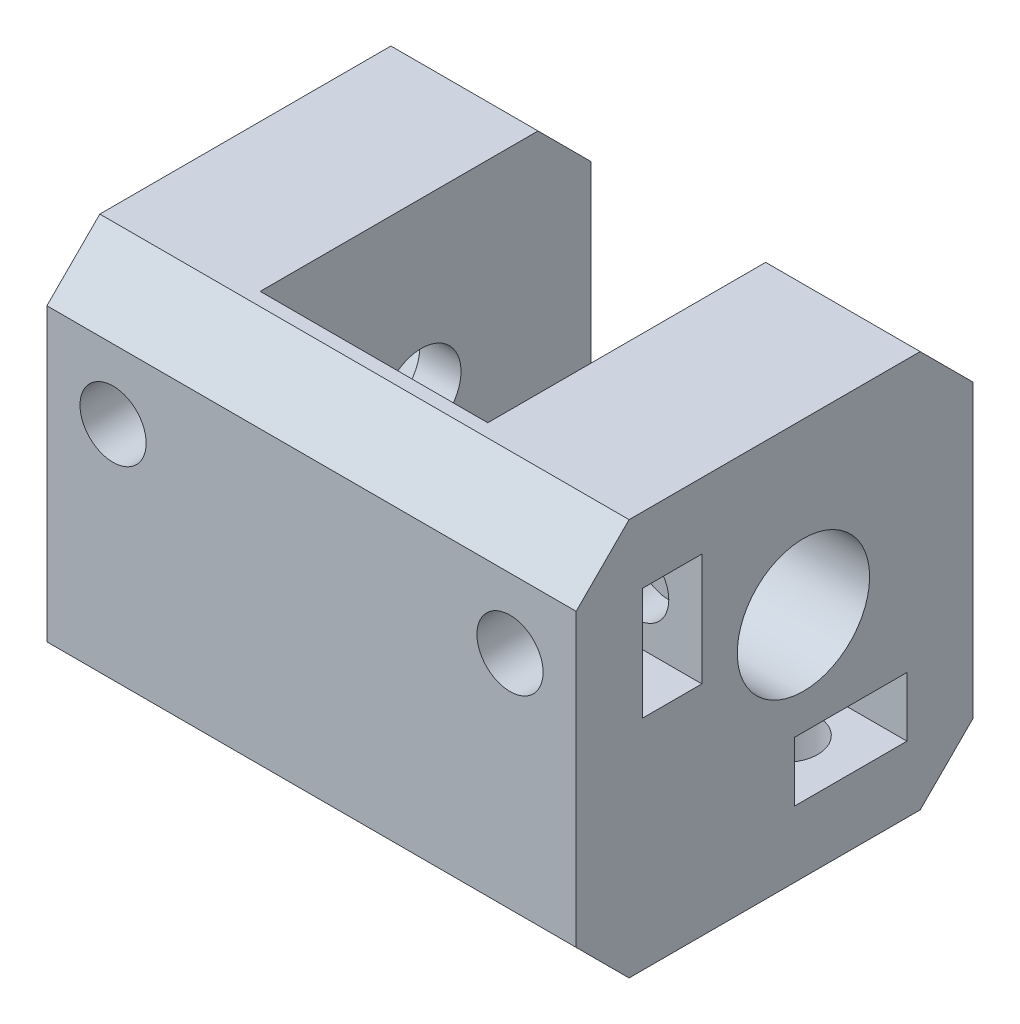
from build123d import *

# Parameters (mm, degrees)
SKETCH1_W           = 39.999999999
SKETCH1_H           = 30
BOSS_EXTRUDE1_DEPTH = 30
SKETCH2_W           = 17.2
SKETCH2_H           = 33.728920846
CUT_EXTRUDE1_DEPTH  = 25
SKETCH3_R           = 3
CUT_EXTRUDE2_DEPTH  = 77.38910698
SKETCH4_W           = 8.5
SKETCH4_H           = 4.5
SKETCH4_W_2         = 4.5
SKETCH4_H_2         = 8.5
CUT_EXTRUDE3_DEPTH  = 9
CUT_EXTRUDE4_START  = -40
SKETCH4_2_W         = 8.5
SKETCH4_2_H         = 4.5
SKETCH4_2_W_2       = 4.5
SKETCH4_2_H_2       = 8.5
CUT_EXTRUDE4_DEPTH  = 9
SKETCH5_R           = 2.5
CUT_EXTRUDE5_DEPTH  = 12
CHAMFER1_SIZE       = 4
SKETCH6_R           = 5
CUT_EXTRUDE6_DEPTH  = 8
CUT_EXTRUDE7_DEPTH  = 8


with BuildPart() as part:
    # Sketch1 → Boss-Extrude1 (new body)
    with BuildSketch(Plane.XY):
        with Locations((-51.592932584, 42.752018711)):
            Rectangle(SKETCH1_W, SKETCH1_H)
    extrude(amount=BOSS_EXTRUDE1_DEPTH)

    # Sketch2 → Cut-Extrude1 (cut)
    with BuildSketch(Plane(origin=(0, 57.752018711, 0), x_dir=(1, 0, 0), z_dir=(0, 1, 0))):
        with Locations((-51.872932582, -8.135539577)):
            Rectangle(SKETCH2_W, SKETCH2_H)
    extrude(amount=-CUT_EXTRUDE1_DEPTH, mode=Mode.SUBTRACT)

    # Sketch3 → Cut-Extrude2 (cut, through all)
    with BuildSketch(Plane(origin=(-31.592932584, 0, 0), x_dir=(0, 0, -1), z_dir=(1, 0, 0))):
        with Locations((-12.822072937, 44.929945774)):
            Circle(SKETCH3_R)
    extrude(amount=-CUT_EXTRUDE2_DEPTH, mode=Mode.SUBTRACT)

    # Sketch4 → Cut-Extrude3 (cut)
    with BuildSketch(Plane(origin=(-31.592932584, 0, 0), x_dir=(0, 0, -1), z_dir=(1, 0, 0))):
        with Locations((-9.25, 35.002018711)):
            Rectangle(SKETCH4_W, SKETCH4_H)
        with Locations((-22.75, 48.502018711)):
            Rectangle(SKETCH4_W_2, SKETCH4_H_2)
    extrude(amount=-CUT_EXTRUDE3_DEPTH, mode=Mode.SUBTRACT)

    # Sketch4<2> → Cut-Extrude4 (cut)
    with BuildSketch(Plane(origin=(-31.592932584, 0, 0), x_dir=(0, 0, -1), z_dir=(1, 0, 0)).offset(CUT_EXTRUDE4_START)):
        with Locations((-9.25, 35.002018711)):
            Rectangle(SKETCH4_2_W, SKETCH4_2_H)
        with Locations((-22.75, 48.502018711)):
            Rectangle(SKETCH4_2_W_2, SKETCH4_2_H_2)
    extrude(amount=CUT_EXTRUDE4_DEPTH, mode=Mode.SUBTRACT)

    # Sketch5 → Cut-Extrude5 (cut)
    with BuildSketch(Plane.XY.offset(30)):
        with Locations((-66.592932583, 48.502018711)):
            Circle(SKETCH5_R)
        with Locations((-36.592932584, 48.502018711)):
            Circle(SKETCH5_R)
    cut_extrude5 = extrude(amount=-CUT_EXTRUDE5_DEPTH, mode=Mode.SUBTRACT)

    # Mirror1: Cut-Extrude5 across plane
    add(cut_extrude5.mirror(Plane(origin=(0, 28.876009355, 28.876009355), x_dir=(0, -0.7071067811865478, 0.7071067811865472), z_dir=(0, -0.7071067811865475, -0.7071067811865477))), mode=Mode.SUBTRACT)

    # Chamfer1
    chamfer1_edges = [part.edges().sort_by_distance(p)[0] for p in [
        (-51.592932584, 27.752018711, 30),
        (-66.032932583, 57.752018711, 0),
        (-51.592932584, 27.752018711, 0),
        (-37.432932583, 57.752018711, 0),
        (-51.592932584, 57.752018711, 30),
    ]]
    chamfer(chamfer1_edges, length=CHAMFER1_SIZE)

    # Sketch6 → Cut-Extrude6 (cut)
    with BuildSketch(Plane(origin=(-31.592932584, 0, 0), x_dir=(0, 0, -1), z_dir=(1, 0, 0))):
        with Locations((-12.822072937, 44.929945774)):
            Circle(SKETCH6_R)
    extrude(amount=-CUT_EXTRUDE6_DEPTH, mode=Mode.SUBTRACT)

    # Sketch7 → Cut-Extrude7 (cut)
    with BuildSketch(Plane.ZY.offset(71.592932583)):
        Polygon((15.304679094, 40.629945774), (17.787285252, 44.929945774), (15.304679094, 49.229945774), (10.339466779, 49.229945774), (7.856860622, 44.929945774), (10.339466779, 40.629945774), align=None)
    extrude(amount=-CUT_EXTRUDE7_DEPTH, mode=Mode.SUBTRACT)


solid = part.part
